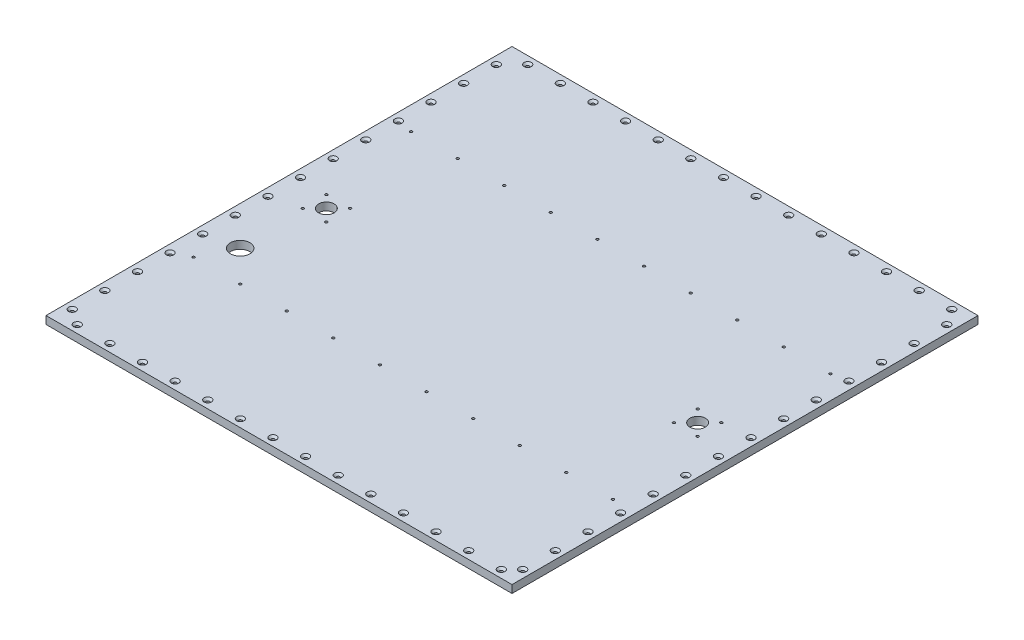
from build123d import *

# Parameters (mm, degrees)
SKETCH1_W                                       = 600
SKETCH1_H                                       = 600
BOSS_EXTRUDE1_DEPTH                             = 10
CSK_FOR_M4_FLAT_HEAD_MACHINE_SCREW1_D           = 4.3
CSK_FOR_M4_FLAT_HEAD_MACHINE_SCREW1_CSINK_D     = 9.4
CSK_FOR_M4_FLAT_HEAD_MACHINE_SCREW1_CSINK_ANGLE = 90
CSK_FOR_M3_FLAT_HEAD_MACHINE_SCREW1_D           = 3.2
CSK_FOR_M3_FLAT_HEAD_MACHINE_SCREW1_CSINK_D     = 6.3
CSK_FOR_M3_FLAT_HEAD_MACHINE_SCREW1_CSINK_ANGLE = 90
SKETCH7_R                                       = 10
CUT_EXTRUDE1_DEPTH                              = 10
CSK_FOR_M3_FLAT_HEAD_MACHINE_SCREW2_D           = 3.2
CSK_FOR_M3_FLAT_HEAD_MACHINE_SCREW2_CSINK_D     = 6.3
CSK_FOR_M3_FLAT_HEAD_MACHINE_SCREW2_CSINK_ANGLE = 90
CSK_FOR_M3_FLAT_HEAD_MACHINE_SCREW3_D           = 3.2
CSK_FOR_M3_FLAT_HEAD_MACHINE_SCREW3_CSINK_D     = 6.3
CSK_FOR_M3_FLAT_HEAD_MACHINE_SCREW3_CSINK_ANGLE = 90
CSK_FOR_M3_FLAT_HEAD_MACHINE_SCREW4_D           = 3.2
CSK_FOR_M3_FLAT_HEAD_MACHINE_SCREW4_DEPTH       = 6
CSK_FOR_M3_FLAT_HEAD_MACHINE_SCREW4_CSINK_D     = 6.3
CSK_FOR_M3_FLAT_HEAD_MACHINE_SCREW4_CSINK_ANGLE = 90
CSK_FOR_M3_FLAT_HEAD_MACHINE_SCREW4_TIP         = 0.96137699
SKETCH14_R                                      = 4
CUT_EXTRUDE2_DEPTH                              = 5
SKETCH15_R                                      = 4
CUT_EXTRUDE3_DEPTH                              = 5
SKETCH16_R                                      = 12.5
CUT_EXTRUDE4_DEPTH                              = 10


with BuildPart() as part:
    # Sketch1 → Boss-Extrude1 (new body)
    with BuildSketch(Plane(origin=(0, 0, 0), x_dir=(1, 0, 0), z_dir=(0, 1, 0))):
        with Locations((300, 300)):
            Rectangle(SKETCH1_W, SKETCH1_H)
    extrude(amount=BOSS_EXTRUDE1_DEPTH)

    # CSK for M4 Flat Head Machine Screw1 (through all)
    with Locations(Plane(origin=(0, 10, 0), x_dir=(1, 0, 0), z_dir=(0, 1, 0))):
        with Locations((10, 569.75), (30.25, 590), (72.25, 590), (114.25, 590), (156.25, 590), (198.25, 590), (240.25, 590), (282.25, 590), (324.25, 590), (366.25, 590), (408.25, 590), (450.25, 590), (492.25, 590), (534.25, 590), (576.25, 590), (72.25, 10), (114.25, 10), (156.25, 10), (198.25, 10), (240.25, 10), (282.25, 10), (324.25, 10), (366.25, 10), (408.25, 10), (450.25, 10), (492.25, 10), (534.25, 10), (576.25, 10), (30.25, 10), (590, 569.75), (590, 527.75), (590, 485.75), (590, 443.75), (590, 401.75), (590, 359.75), (590, 317.75), (590, 275.75), (590, 233.75), (590, 191.75), (590, 149.75), (590, 107.75), (590, 65.75), (590, 23.75), (10, 527.75), (10, 485.75), (10, 443.75), (10, 401.75), (10, 359.75), (10, 317.75), (10, 275.75), (10, 233.75), (10, 191.75), (10, 149.75), (10, 107.75), (10, 65.75), (10, 23.75)):
            CounterSinkHole(CSK_FOR_M4_FLAT_HEAD_MACHINE_SCREW1_D / 2, CSK_FOR_M4_FLAT_HEAD_MACHINE_SCREW1_CSINK_D / 2, counter_sink_angle=CSK_FOR_M4_FLAT_HEAD_MACHINE_SCREW1_CSINK_ANGLE)

    # CSK for M3 Flat Head Machine Screw1 (through all)
    with Locations(Plane(origin=(0, 0, 0), x_dir=(-1, 0, 0), z_dir=(0, -1, 0))):
        with Locations((-570, 160), (-570, 440), (-510, 160), (-510, 440), (-450, 160), (-450, 440), (-390, 160), (-390, 440), (-330, 160), (-330, 440), (-270, 160), (-270, 440), (-210, 160), (-210, 440), (-150, 160), (-150, 440), (-90, 160), (-90, 440), (-30, 160), (-30, 440)):
            CounterSinkHole(CSK_FOR_M3_FLAT_HEAD_MACHINE_SCREW1_D / 2, CSK_FOR_M3_FLAT_HEAD_MACHINE_SCREW1_CSINK_D / 2, counter_sink_angle=CSK_FOR_M3_FLAT_HEAD_MACHINE_SCREW1_CSINK_ANGLE)

    # Sketch7 → Cut-Extrude1 (cut)
    with BuildSketch(Plane(origin=(0, 0, 0), x_dir=(-1, 0, 0), z_dir=(0, -1, 0))):
        with Locations(Location((-61, 300, 0), (0, 0, 90))):
            Circle(SKETCH7_R)
        with Locations(Location((-539, 300, 0), (0, 0, 90))):
            Circle(SKETCH7_R)
    extrude(amount=-CUT_EXTRUDE1_DEPTH, mode=Mode.SUBTRACT)

    # CSK for M3 Flat Head Machine Screw2 (through all)
    with Locations(Plane(origin=(0, 0, 0), x_dir=(-1, 0, 0), z_dir=(0, -1, 0))):
        with Locations((-45.75, 315.25), (-76.25, 315.25), (-76.25, 284.75), (-45.75, 284.75)):
            CounterSinkHole(CSK_FOR_M3_FLAT_HEAD_MACHINE_SCREW2_D / 2, CSK_FOR_M3_FLAT_HEAD_MACHINE_SCREW2_CSINK_D / 2, counter_sink_angle=CSK_FOR_M3_FLAT_HEAD_MACHINE_SCREW2_CSINK_ANGLE)

    # CSK for M3 Flat Head Machine Screw3 (through all)
    with Locations(Plane(origin=(0, 0, 0), x_dir=(-1, 0, 0), z_dir=(0, -1, 0))):
        with Locations((-523.75, 315.25), (-554.25, 315.25), (-554.25, 284.75), (-523.75, 284.75)):
            CounterSinkHole(CSK_FOR_M3_FLAT_HEAD_MACHINE_SCREW3_D / 2, CSK_FOR_M3_FLAT_HEAD_MACHINE_SCREW3_CSINK_D / 2, counter_sink_angle=CSK_FOR_M3_FLAT_HEAD_MACHINE_SCREW3_CSINK_ANGLE)

    # CSK for M3 Flat Head Machine Screw4
    with Locations(Plane(origin=(0, 0, 0), x_dir=(-1, 0, 0), z_dir=(0, -1, 0))):
        with Locations((-549.5, 118.5), (-549.5, 68.8), (-397.5, 118.5), (-397.5, 68.8)):
            CounterSinkHole(CSK_FOR_M3_FLAT_HEAD_MACHINE_SCREW4_D / 2, CSK_FOR_M3_FLAT_HEAD_MACHINE_SCREW4_CSINK_D / 2, depth=CSK_FOR_M3_FLAT_HEAD_MACHINE_SCREW4_DEPTH, counter_sink_angle=CSK_FOR_M3_FLAT_HEAD_MACHINE_SCREW4_CSINK_ANGLE)
            with Locations((0, 0, -(CSK_FOR_M3_FLAT_HEAD_MACHINE_SCREW4_DEPTH + CSK_FOR_M3_FLAT_HEAD_MACHINE_SCREW4_TIP / 2))):  # 118° drill point
                Cone(0, CSK_FOR_M3_FLAT_HEAD_MACHINE_SCREW4_D / 2, CSK_FOR_M3_FLAT_HEAD_MACHINE_SCREW4_TIP, mode=Mode.SUBTRACT)

    # Sketch14 → Cut-Extrude2 (cut)
    with BuildSketch(Plane.XZ):
        with Locations(Location((425, -42, 0), (0, 0, 270))):
            Circle(SKETCH14_R)
    extrude(amount=-CUT_EXTRUDE2_DEPTH, mode=Mode.SUBTRACT)

    # Sketch15 → Cut-Extrude3 (cut)
    with BuildSketch(Plane(origin=(0, 0, 0), x_dir=(-1, 0, 0), z_dir=(0, -1, 0))):
        with Locations(Location((-175, 42, 0), (0, 0, 90))):
            Circle(SKETCH15_R)
    extrude(amount=-CUT_EXTRUDE3_DEPTH, mode=Mode.SUBTRACT)

    # Sketch16 → Cut-Extrude4 (cut)
    with BuildSketch(Plane(origin=(0, 10, 0), x_dir=(1, 0, 0), z_dir=(0, 1, 0))):
        with Locations(Location((50, 200, 0), (0, 0, 270))):
            Circle(SKETCH16_R)
    extrude(amount=-CUT_EXTRUDE4_DEPTH, mode=Mode.SUBTRACT)


solid = part.part
